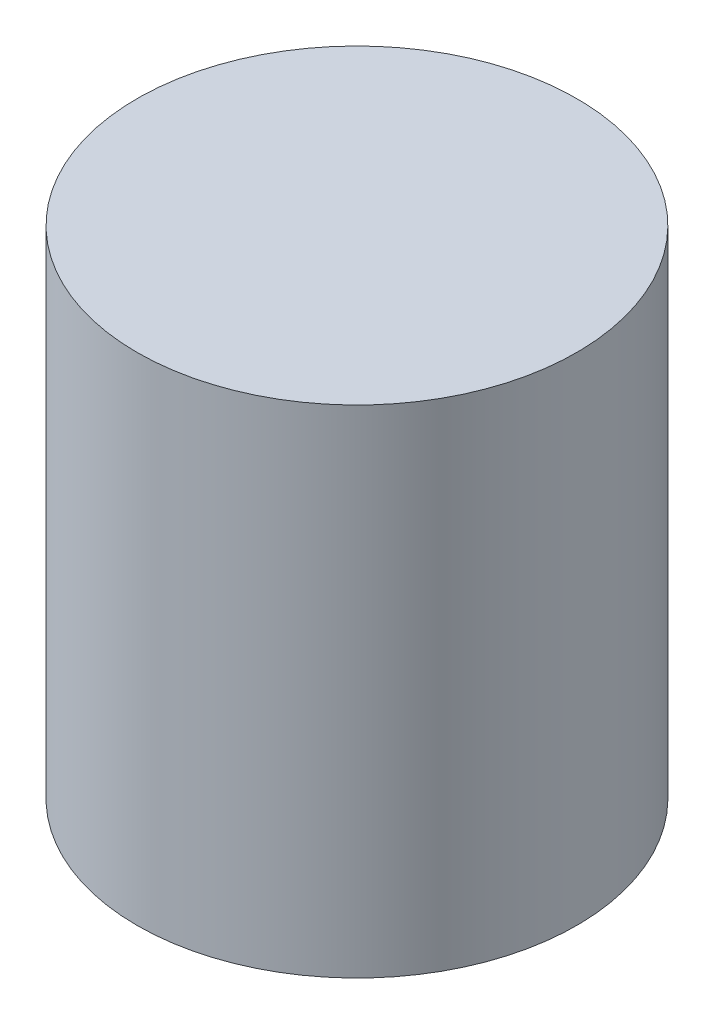
from build123d import *

# Parameters (mm, degrees)
ESQUISSE1_R        = 1.75
BOSS_EXTRU_1_DEPTH = 3.95


with BuildPart() as part:
    # Esquisse1 → Boss.-Extru.1 (new body)
    with BuildSketch(Plane(origin=(0, 0, 0), x_dir=(1, 0, 0), z_dir=(0, 1, 0))):
        with Locations(Location((0, 0, 0), (0, 0, 270))):
            Circle(ESQUISSE1_R)
    extrude(amount=BOSS_EXTRU_1_DEPTH)


solid = part.part
